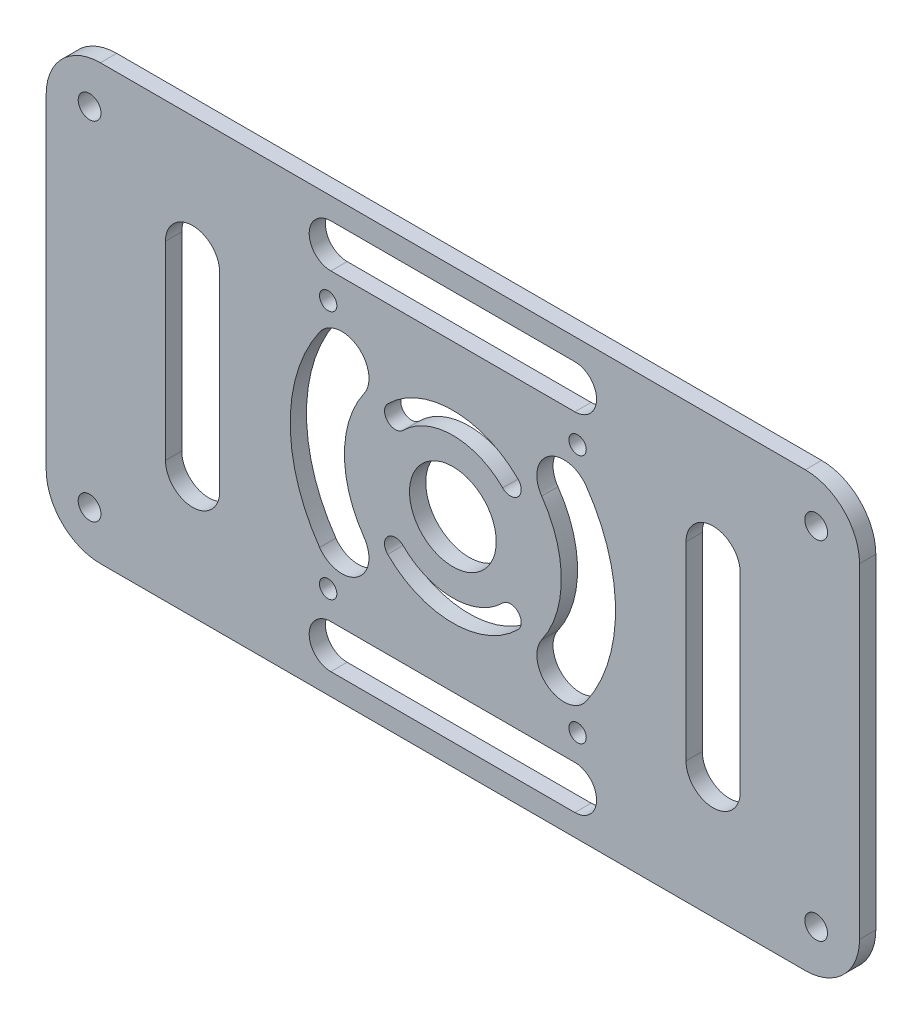
from build123d import *

# Parameters (mm, degrees)
SKETCH_1_R          = 2.1
EXTRUDE_1_DEPTH     = 3
SKETCH_2_R          = 1.6
SKETCH_2_R_2        = 8
CUT_EXTRUDE_1_DEPTH = 3
CUT_EXTRUDE_2_DEPTH = 3
CUT_EXTRUDE_3_DEPTH = 3


with BuildPart() as part:
    # 草图1 → 凸台-拉伸1 (new body)
    with BuildSketch(Plane.XY):
        with BuildLine():
            Line((10, 0), (140, 0))
            ThreePointArc((140, 0), (147.071067812, -2.928932188), (150, -10))
            Line((150, -10), (150, -70))
            ThreePointArc((150, -70), (147.071067812, -77.071067812), (140, -80))
            Line((140, -80), (10, -80))
            ThreePointArc((10, -80), (2.928932188, -77.071067812), (0, -70))
            Line((0, -70), (0, -10))
            ThreePointArc((0, -10), (2.928932188, -2.928932188), (10, 0))
        make_face()
        with Locations((8, -8)):
            Circle(SKETCH_1_R, mode=Mode.SUBTRACT)
        with Locations(Location((8, -72, 0), (0, 0, 180))):
            Circle(SKETCH_1_R, mode=Mode.SUBTRACT)
        with Locations((142, -72)):
            Circle(SKETCH_1_R, mode=Mode.SUBTRACT)
        with Locations(Location((142, -8, 0), (0, 0, 180))):
            Circle(SKETCH_1_R, mode=Mode.SUBTRACT)
    extrude(amount=EXTRUDE_1_DEPTH)

    # 草图2 → 切除-拉伸1 (cut)
    with BuildSketch(Plane.XY.offset(3)):
        with Locations((52, -17)):
            Circle(SKETCH_2_R)
        with Locations((98, -17)):
            Circle(SKETCH_2_R)
        with Locations((98, -63)):
            Circle(SKETCH_2_R)
        with Locations((52, -63)):
            Circle(SKETCH_2_R)
        with Locations((75, -40)):
            Circle(SKETCH_2_R_2)
        with BuildLine():
            ThreePointArc((87.02081528, -27.97918472), (75, -23), (62.97918472, -27.97918472))
            ThreePointArc((62.97918472, -27.97918472), (62.97918472, -30.807611845), (65.807611845, -30.807611845))
            ThreePointArc((65.807611845, -30.807611845), (75, -27), (84.192388155, -30.807611845))
            ThreePointArc((84.192388155, -30.807611845), (87.02081528, -30.807611845), (87.02081528, -27.97918472))
        make_face()
        with BuildLine():
            ThreePointArc((87.02081528, -52.02081528), (75, -57), (62.97918472, -52.02081528))
            ThreePointArc((62.97918472, -52.02081528), (62.97918472, -49.192388155), (65.807611845, -49.192388155))
            ThreePointArc((65.807611845, -49.192388155), (75, -53), (84.192388155, -49.192388155))
            ThreePointArc((84.192388155, -49.192388155), (87.02081528, -49.192388155), (87.02081528, -52.02081528))
        make_face()
    extrude(amount=-CUT_EXTRUDE_1_DEPTH, mode=Mode.SUBTRACT)

    # 草图3 → 切除-拉伸2 (cut)
    with BuildSketch(Plane.XY.offset(3)):
        with BuildLine():
            Line((128, -22.5), (128, -57.5))
            ThreePointArc((128, -57.5), (123, -62.5), (118, -57.5))
            Line((118, -57.5), (118, -22.5))
            ThreePointArc((118, -22.5), (123, -17.5), (128, -22.5))
        make_face()
        with BuildLine():
            Line((22, -22.5), (22, -57.5))
            ThreePointArc((22, -57.5), (27, -62.5), (32, -57.5))
            Line((32, -57.5), (32, -22.5))
            ThreePointArc((32, -22.5), (27, -17.5), (22, -22.5))
        make_face()
        with BuildLine():
            ThreePointArc((99.574561329, -57.207293091), (105, -40), (99.574561329, -22.792706909))
            ThreePointArc((99.574561329, -22.792706909), (92.610918925, -21.56482887), (91.383040886, -28.528471273))
            ThreePointArc((91.383040886, -28.528471273), (95, -40), (91.383040886, -51.471528727))
            ThreePointArc((91.383040886, -51.471528727), (92.610918925, -58.43517113), (99.574561329, -57.207293091))
        make_face()
        with BuildLine():
            ThreePointArc((50.425438671, -57.207293091), (45, -40), (50.425438671, -22.792706909))
            ThreePointArc((50.425438671, -22.792706909), (57.389081075, -21.56482887), (58.616959114, -28.528471273))
            ThreePointArc((58.616959114, -28.528471273), (55, -40), (58.616959114, -51.471528727))
            ThreePointArc((58.616959114, -51.471528727), (57.389081075, -58.43517113), (50.425438671, -57.207293091))
        make_face()
    extrude(amount=-CUT_EXTRUDE_2_DEPTH, mode=Mode.SUBTRACT)

    # 草图4 → 切除-拉伸3 (cut)
    with BuildSketch(Plane(origin=(0, 0, 0), x_dir=(-1, 0, 0), z_dir=(0, 0, -1))):
        with BuildLine():
            Line((-97.5, -4), (-52.5, -4))
            ThreePointArc((-52.5, -4), (-48.5, -8), (-52.5, -12))
            Line((-52.5, -12), (-97.5, -12))
            ThreePointArc((-97.5, -12), (-101.5, -8), (-97.5, -4))
        make_face()
        with BuildLine():
            Line((-97.5, -76), (-52.5, -76))
            ThreePointArc((-52.5, -76), (-48.5, -72), (-52.5, -68))
            Line((-52.5, -68), (-97.5, -68))
            ThreePointArc((-97.5, -68), (-101.5, -72), (-97.5, -76))
        make_face()
    extrude(amount=-CUT_EXTRUDE_3_DEPTH, mode=Mode.SUBTRACT)


solid = part.part
